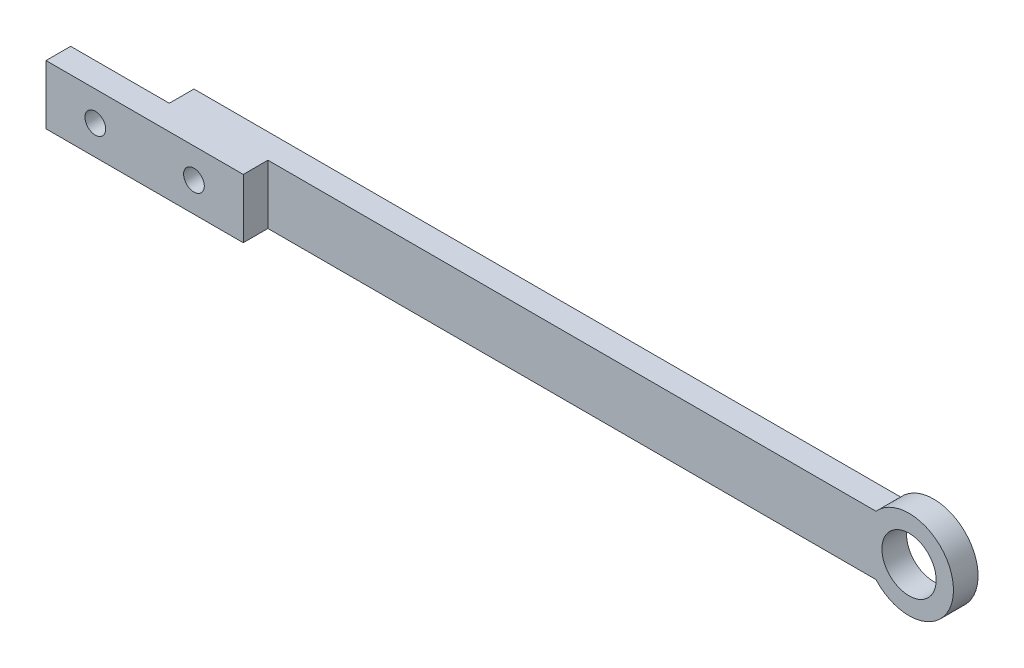
from build123d import *

# Parameters (mm, degrees)
BOSS_EXTRUDE1_DEPTH = 5
SKETCH2_R           = 5.5
CUT_EXTRUDE1_DEPTH  = 151.352918163
SKETCH3_W           = 40
SKETCH3_H           = 12
BOSS_EXTRUDE2_DEPTH = 5
SKETCH4_R           = 2.1
CUT_EXTRUDE2_DEPTH  = 171.531522013


with BuildPart() as part:
    # Sketch1 → Boss-Extrude1 (new body)
    with BuildSketch(Plane.XY):
        with BuildLine():
            Line((-6.708203932, 6), (-150, 6))
            Line((-150, 6), (-150, -6))
            Line((-150, -6), (-6.708203932, -6))
            ThreePointArc((-6.708203932, -6), (9, 0), (-6.708203932, 6))
        make_face()
    extrude(amount=BOSS_EXTRUDE1_DEPTH)

    # Sketch2 → Cut-Extrude1 (cut, through all)
    with BuildSketch(Plane.XY.offset(5)):
        Circle(SKETCH2_R)
    extrude(amount=-CUT_EXTRUDE1_DEPTH, mode=Mode.SUBTRACT)

    # Sketch3 → Boss-Extrude2 (add)
    with BuildSketch(Plane.XY.offset(5)):
        with Locations((-150, 0)):
            Rectangle(SKETCH3_W, SKETCH3_H)
    extrude(amount=BOSS_EXTRUDE2_DEPTH)

    # Sketch4 → Cut-Extrude2 (cut, through all)
    with BuildSketch(Plane.XY.offset(10)):
        with Locations((-160, 0)):
            Circle(SKETCH4_R)
        with Locations((-140, 0)):
            Circle(SKETCH4_R)
    extrude(amount=-CUT_EXTRUDE2_DEPTH, mode=Mode.SUBTRACT)


solid = part.part
